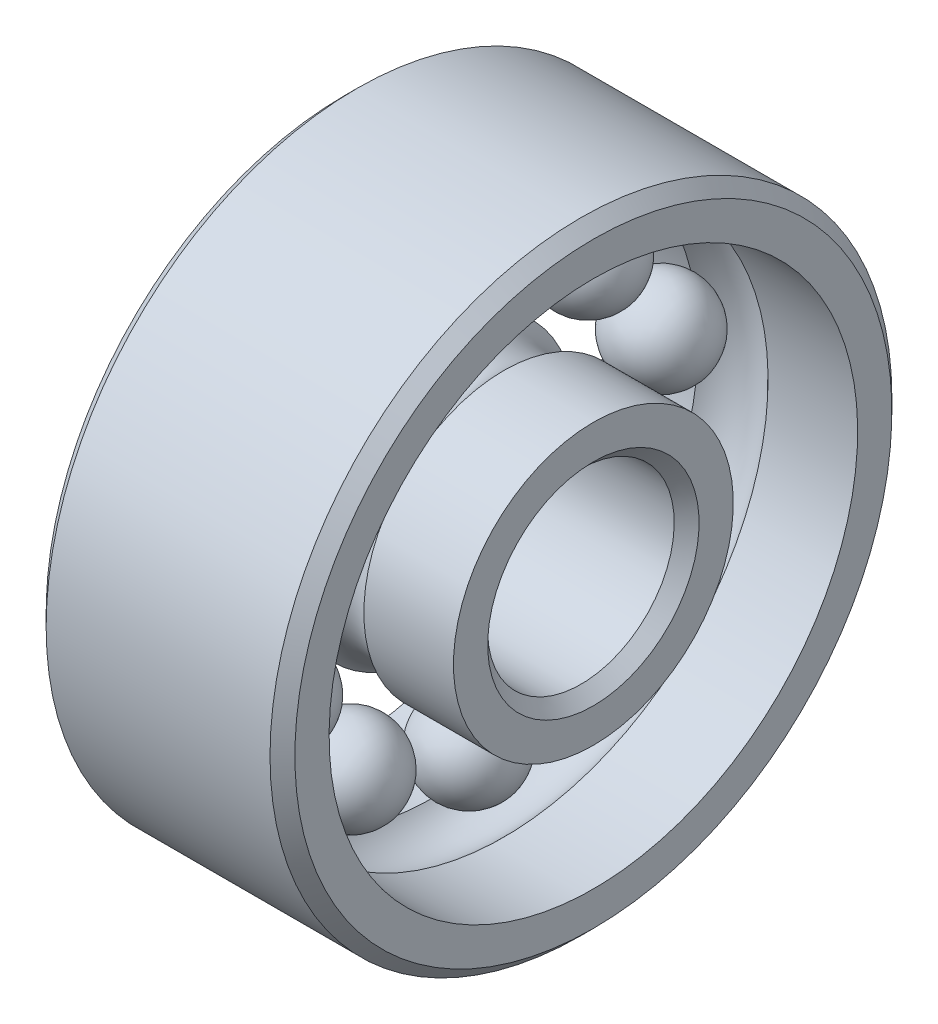
from build123d import *

# Parameters (mm, degrees)
CIRPATTERN4_COUNT = 10
CHAMFER1_SIZE     = 0.2
CHAMFER2_SIZE     = 0.2


with BuildPart() as part:
    # Sketch1 → Revolve1 (revolve)
    with BuildSketch(Plane.XY):
        with BuildLine():
            Line((2, 1.5), (-2, 1.5))
            Line((-2, 1.5), (-2, 2.25))
            Line((-2, 2.25), (-0.559016994, 2.25))
            ThreePointArc((-0.559016994, 2.25), (0, 2), (0.559016994, 2.25))
            Line((0.559016994, 2.25), (2, 2.25))
            Line((2, 2.25), (2, 1.5))
        make_face()
        with BuildLine():
            Line((-2, 4.25), (-2, 5))
            Line((-2, 5), (2, 5))
            Line((2, 5), (2, 4.25))
            Line((2, 4.25), (0.559016994, 4.25))
            ThreePointArc((0.559016994, 4.25), (0, 4.5), (-0.559016994, 4.25))
            Line((-0.559016994, 4.25), (-2, 4.25))
        make_face()
    revolve(axis=Axis((1.058927467, 0, 0), (-1, 0, 0)))

    # Chamfer1
    chamfer1_edges = [part.edges().sort_by_distance(p)[0] for p in [
        (2, -5, 0),
        (-2, -5, 0),
    ]]
    chamfer(chamfer1_edges, length=CHAMFER1_SIZE)

    # Chamfer2
    chamfer2_edges = [part.edges().sort_by_distance(p)[0] for p in [
        (2, -1.5, 0),
        (-2, -1.5, 0),
    ]]
    chamfer(chamfer2_edges, length=CHAMFER2_SIZE)


with BuildPart() as body_2:
    # Sketch2 → Revolve2 (revolve)
    with BuildSketch(Plane.XY):
        with BuildLine():
            Line((-0.75, 3.25), (0.75, 3.25))
            ThreePointArc((0.75, 3.25), (0, 4), (-0.75, 3.25))
        make_face()
    revolve(axis=Axis((-0.75, 3.25, 0), (1, 0, 0)))


with BuildPart() as cirpattern4_1:
    # CirPattern4: pattern copy
    add(body_2.part.rotate(Axis((0, 0, 0), (1, 0, 0)), 1 * 360 / CIRPATTERN4_COUNT))


with BuildPart() as cirpattern4_2:
    # CirPattern4: pattern copy
    add(body_2.part.rotate(Axis((0, 0, 0), (1, 0, 0)), 2 * 360 / CIRPATTERN4_COUNT))


with BuildPart() as cirpattern4_3:
    # CirPattern4: pattern copy
    add(body_2.part.rotate(Axis((0, 0, 0), (1, 0, 0)), 3 * 360 / CIRPATTERN4_COUNT))


with BuildPart() as cirpattern4_4:
    # CirPattern4: pattern copy
    add(body_2.part.rotate(Axis((0, 0, 0), (1, 0, 0)), 4 * 360 / CIRPATTERN4_COUNT))


with BuildPart() as cirpattern4_5:
    # CirPattern4: pattern copy
    add(body_2.part.rotate(Axis((0, 0, 0), (1, 0, 0)), 5 * 360 / CIRPATTERN4_COUNT))


with BuildPart() as cirpattern4_6:
    # CirPattern4: pattern copy
    add(body_2.part.rotate(Axis((0, 0, 0), (1, 0, 0)), 6 * 360 / CIRPATTERN4_COUNT))


with BuildPart() as cirpattern4_7:
    # CirPattern4: pattern copy
    add(body_2.part.rotate(Axis((0, 0, 0), (1, 0, 0)), 7 * 360 / CIRPATTERN4_COUNT))


with BuildPart() as cirpattern4_8:
    # CirPattern4: pattern copy
    add(body_2.part.rotate(Axis((0, 0, 0), (1, 0, 0)), 8 * 360 / CIRPATTERN4_COUNT))


with BuildPart() as cirpattern4_9:
    # CirPattern4: pattern copy
    add(body_2.part.rotate(Axis((0, 0, 0), (1, 0, 0)), 9 * 360 / CIRPATTERN4_COUNT))


solid = Compound([part.part, body_2.part, cirpattern4_1.part, cirpattern4_2.part, cirpattern4_3.part, cirpattern4_4.part, cirpattern4_5.part, cirpattern4_6.part, cirpattern4_7.part, cirpattern4_8.part, cirpattern4_9.part])
